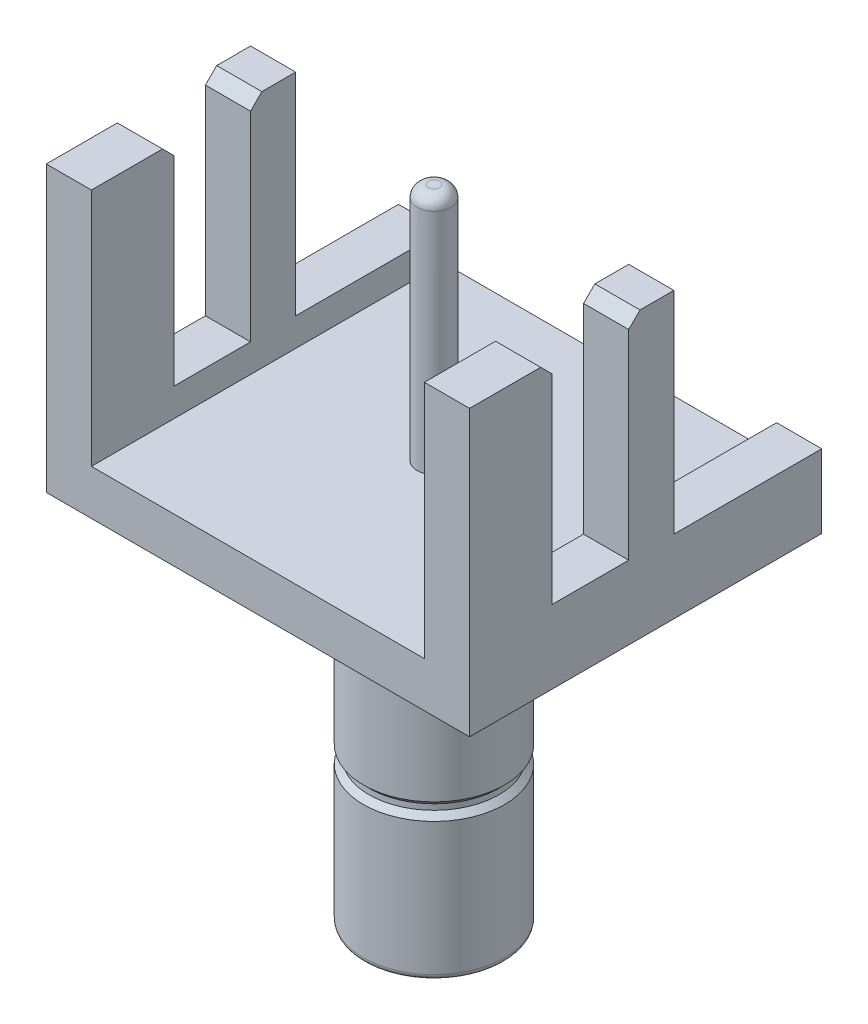
from build123d import *

# Parameters (mm, degrees)
SKETCH1_W           = 9.525
SKETCH1_H           = 7.9248
BOSS_EXTRUDE1_DEPTH = 1.016
SKETCH2_W           = 1.016
SKETCH2_H           = 7.9248
BOSS_EXTRUDE2_DEPTH = 0.635
SKETCH3_W           = 1.016
SKETCH3_H           = 1.8542
SKETCH3_H_2         = 1.016
BOSS_EXTRUDE3_DEPTH = 4.7498
CHAMFER1_SIZE       = 0.254
SKETCH4_R           = 0.381
BOSS_EXTRUDE4_DEPTH = 5.3848
FILLET1_R           = 0.254
BOSS_EXTRUDE5_START = 8.001
SKETCH5_R           = 1.5875
SKETCH5_R_2         = 1.27
SKETCH5_R_3         = 0.381
BOSS_EXTRUDE5_DEPTH = 8.001
SKETCH7_R           = 0.381
CUT_EXTRUDE1_DEPTH  = 1.524
SKETCH8_R           = 0.381
BOSS_EXTRUDE6_DEPTH = 0.762
BOSS_EXTRUDE6_TAPER = 15
FILLET2_R           = 0.127
FILLET3_R           = 0.127


with BuildPart() as part:
    # Sketch1 → Boss-Extrude1 (new body)
    with BuildSketch(Plane(origin=(0, 0, 0), x_dir=(1, 0, 0), z_dir=(0, 1, 0))):
        Rectangle(SKETCH1_W, SKETCH1_H)
    extrude(amount=BOSS_EXTRUDE1_DEPTH)

    # Sketch2 → Boss-Extrude2 (add)
    with BuildSketch(Plane(origin=(0, 1.016, 0), x_dir=(1, 0, 0), z_dir=(0, 1, 0))):
        with Locations((-4.2545, 0)):
            Rectangle(SKETCH2_W, SKETCH2_H)
        with Locations((4.2545, 0)):
            Rectangle(SKETCH2_W, SKETCH2_H)
    extrude(amount=BOSS_EXTRUDE2_DEPTH)

    # Sketch3 → Boss-Extrude3 (add)
    with BuildSketch(Plane(origin=(0, 1.651, 0), x_dir=(1, 0, 0), z_dir=(0, 1, 0))):
        with Locations((-4.2545, -3.0353)):
            Rectangle(SKETCH3_W, SKETCH3_H)
        with Locations((-4.2545, 0.127)):
            Rectangle(SKETCH3_W, SKETCH3_H_2)
        with Locations((4.2545, 0.127)):
            Rectangle(SKETCH3_W, SKETCH3_H_2)
        with Locations((4.2545, -3.0353)):
            Rectangle(SKETCH3_W, SKETCH3_H)
    extrude(amount=BOSS_EXTRUDE3_DEPTH)

    # Chamfer1
    chamfer1_edges = [part.edges().sort_by_distance(p)[0] for p in [
        (-4.2545, 6.4008, 2.1082),
        (-4.2545, 6.4008, 0.381),
        (4.2545, 6.4008, 0.381),
        (4.2545, 6.4008, 2.1082),
    ]]
    chamfer(chamfer1_edges, length=CHAMFER1_SIZE)

    # Sketch4 → Boss-Extrude4 (add)
    with BuildSketch(Plane(origin=(0, 1.016, 0), x_dir=(1, 0, 0), z_dir=(0, 1, 0))):
        with Locations(Location((0, 0, 0), (0, 0, 90))):
            Circle(SKETCH4_R)
    extrude(amount=BOSS_EXTRUDE4_DEPTH)

    # Fillet1
    fillet1_edges = [part.edges().sort_by_distance(p)[0] for p in [
        (0, 6.4008, 0.381),
    ]]
    fillet(fillet1_edges, radius=FILLET1_R)

    # Sketch5 → Boss-Extrude5 (add)
    # profile 1 of 2: a face of its own
    with BuildSketch(Plane.XZ.offset(BOSS_EXTRUDE5_START)):
        with Locations(Location((0, 0, 0), (0, 0, 270))):
            Circle(SKETCH5_R)
        with Locations(Location((0, 0, 0), (0, 0, 270))):
            Circle(SKETCH5_R_2, mode=Mode.SUBTRACT)
    # profile 2 of 2: a face of its own
    with BuildSketch(Plane.XZ.offset(BOSS_EXTRUDE5_START)):
        with Locations(Location((0, 0, 0), (0, 0, 270))):
            Circle(SKETCH5_R_3)
    extrude(amount=-BOSS_EXTRUDE5_DEPTH)

    # Sketch6 → Cut-Revolve1 (revolve, cut)
    with BuildSketch(Plane(origin=(0, 0, 0), x_dir=(0, 0, -1), z_dir=(1, 0, 0))):
        Polygon((1.5875, -4.5085), (1.4605, -4.6355), (1.4605, -4.7625), (1.5875, -4.8895), align=None)
    revolve(axis=Axis((0, -8.001, 0), (0, 1, 0)), mode=Mode.SUBTRACT)

    # Sketch7 → Cut-Extrude1 (cut)
    with BuildSketch(Plane.XZ.offset(8.001)):
        with Locations(Location((0, 0, 0), (0, 0, 270))):
            Circle(SKETCH7_R)
    extrude(amount=-CUT_EXTRUDE1_DEPTH, mode=Mode.SUBTRACT)

    # Sketch8 → Boss-Extrude6 (add)
    with BuildSketch(Plane.XZ.offset(6.477)):
        with Locations(Location((0, 0, 0), (0, 0, 270))):
            Circle(SKETCH8_R)
    extrude(amount=BOSS_EXTRUDE6_DEPTH, taper=BOSS_EXTRUDE6_TAPER)

    # Fillet2
    fillet2_edges = [part.edges().sort_by_distance(p)[0] for p in [
        (0, -7.239, 0.176822715),
    ]]
    fillet(fillet2_edges, radius=FILLET2_R)

    # Fillet3
    fillet3_edges = [part.edges().sort_by_distance(p)[0] for p in [
        (0, -8.001, 1.5875),
    ]]
    fillet(fillet3_edges, radius=FILLET3_R)


solid = part.part
